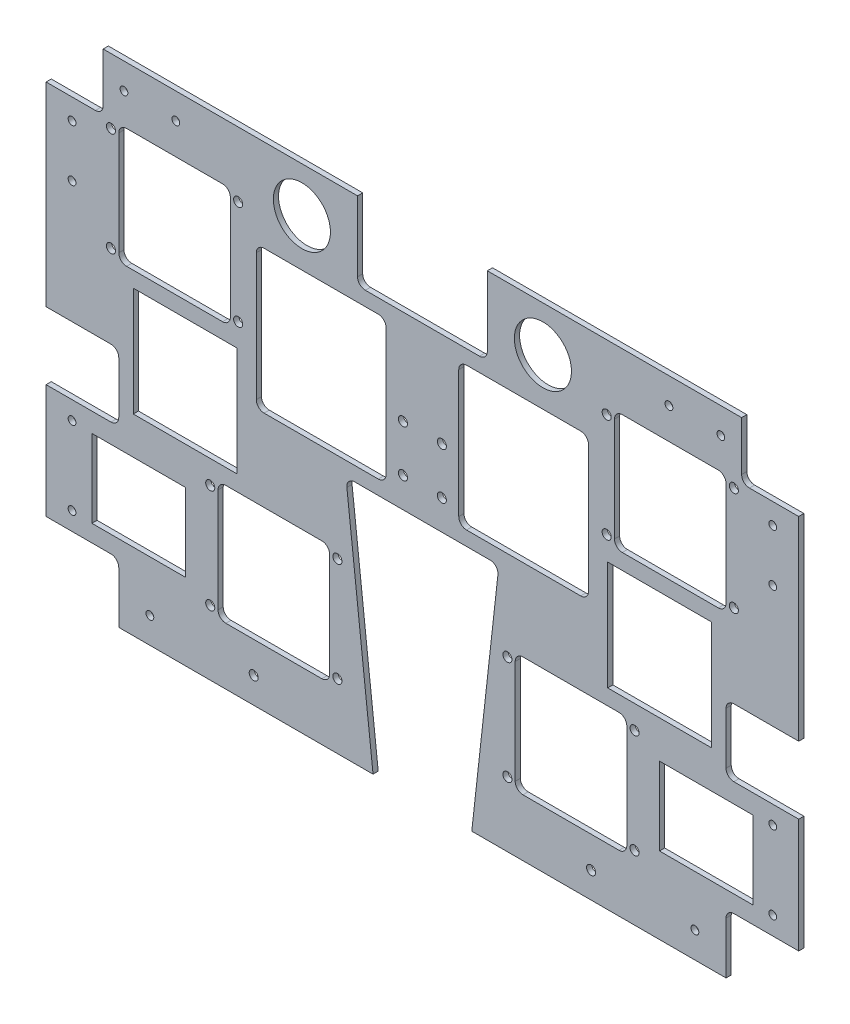
from build123d import *

# Parameters (mm, degrees)
SKETCH_1_W           = 290
SKETCH_1_H           = 190
EXTRUDE_1_DEPTH      = 2
SKETCH_2_W           = 22
SKETCH_2_H           = 22
CUT_EXTRUDE_1_DEPTH  = 2
FILLET_2_R           = 3
FILLET_3_R           = 3
SKETCH_3_W           = 50
SKETCH_3_H           = 30
CUT_EXTRUDE_2_DEPTH  = 10
FILLET_4_R           = 3
CUT_EXTRUDE_3_DEPTH  = 10
FILLET_5_R           = 3
SKETCH_5_R           = 1.75
SKETCH_5_R_2         = 1.5
CUT_EXTRUDE_4_DEPTH  = 10
SKETCH_6_W           = 38.367930324
SKETCH_6_H           = 26
SKETCH_6_W_2         = 43.939038981
CUT_EXTRUDE_5_DEPTH  = 10
FILLET_6_R           = 3
SKETCH_7_R           = 1.75
CUT_EXTRUDE_6_DEPTH  = 10
SKETCH_8_W           = 43
SKETCH_8_H           = 46
CUT_EXTRUDE_7_DEPTH  = 10
FILLET_7_R           = 3
SKETCH_10_R          = 11
SKETCH_10_W          = 40
SKETCH_10_H          = 42
SKETCH_10_W_2        = 36
SKETCH_10_H_2        = 30
CUT_EXTRUDE_9_DEPTH  = 10
SKETCH_11_R          = 1.75
CUT_EXTRUDE_10_DEPTH = 10
SKETCH_9_W           = 50
SKETCH_9_H           = 55
CUT_EXTRUDE_11_DEPTH = 10
FILLET_8_R           = 3


with BuildPart() as part:
    # 草图1 → 凸台-拉伸1 (new body)
    with BuildSketch(Plane.XY):
        Rectangle(SKETCH_1_W, SKETCH_1_H)
    extrude(amount=EXTRUDE_1_DEPTH)

    # 草图2 → 切除-拉伸1 (cut)
    with BuildSketch(Plane(origin=(0, 0, 0), x_dir=(-1, 0, 0), z_dir=(0, 0, -1))):
        with Locations((-134, 84)):
            Rectangle(SKETCH_2_W, SKETCH_2_H)
        with Locations((134, 84)):
            Rectangle(SKETCH_2_W, SKETCH_2_H)
        Polygon((-125, -72), (-145, -72), (-145, -111.869716796), (-117, -111.869716796), (-117, -72), align=None)
        Polygon((117, -72), (125, -72), (145, -72), (145, -111.869716796), (117, -111.869716796), align=None)
    extrude(amount=-CUT_EXTRUDE_1_DEPTH, mode=Mode.SUBTRACT)

    # 圆角2
    fillet_2_edges = [part.edges().sort_by_distance(p)[0] for p in [
        (117, -72, 1),
        (-117, -72, 1),
    ]]
    fillet(fillet_2_edges, radius=FILLET_2_R)

    # 圆角3
    fillet_3_edges = [part.edges().sort_by_distance(p)[0] for p in [
        (-123, 73, 1),
        (123, 73, 1),
    ]]
    fillet(fillet_3_edges, radius=FILLET_3_R)

    # 草图3 → 切除-拉伸2 (cut)
    with BuildSketch(Plane.XY.offset(2)):
        with Locations((0, 80)):
            Rectangle(SKETCH_3_W, SKETCH_3_H)
    extrude(amount=-CUT_EXTRUDE_2_DEPTH, mode=Mode.SUBTRACT)

    # 圆角4
    fillet_4_edges = [part.edges().sort_by_distance(p)[0] for p in [
        (25, 65, 1),
        (-25, 65, 1),
    ]]
    fillet(fillet_4_edges, radius=FILLET_4_R)

    # 草图4 → 切除-拉伸3 (cut)
    with BuildSketch(Plane(origin=(0, 0, 0), x_dir=(-1, 0, 0), z_dir=(0, 0, -1))):
        Polygon((18.975534939, -95.441726104), (29.469060061, -1), (-29.469060061, -1), (-18.975534939, -95.441726104), align=None)
    extrude(amount=-CUT_EXTRUDE_3_DEPTH, mode=Mode.SUBTRACT)

    # 圆角5
    fillet_5_edges = [part.edges().sort_by_distance(p)[0] for p in [
        (29.469060061, -1, 1),
        (-29.469060061, -1, 1),
    ]]
    fillet(fillet_5_edges, radius=FILLET_5_R)

    # 草图5 → 切除-拉伸4 (cut)
    with BuildSketch(Plane(origin=(0, 0, 0), x_dir=(-1, 0, 0), z_dir=(0, 0, -1))):
        with Locations((65, -85)):
            Circle(SKETCH_5_R)
        with Locations((105, -85)):
            Circle(SKETCH_5_R_2)
        with Locations((135, -35)):
            Circle(SKETCH_5_R_2)
        with Locations((-65, -85)):
            Circle(SKETCH_5_R)
        with Locations((-135, -65)):
            Circle(SKETCH_5_R_2)
        with Locations((-135, -35)):
            Circle(SKETCH_5_R_2)
        with Locations((-135, 45)):
            Circle(SKETCH_5_R_2)
        with Locations((-135, 65)):
            Circle(SKETCH_5_R_2)
        with Locations((-115, 85)):
            Circle(SKETCH_5_R_2)
        with Locations((-95, 85)):
            Circle(SKETCH_5_R_2)
        with Locations((95, 85)):
            Circle(SKETCH_5_R_2)
        with Locations((115, 85)):
            Circle(SKETCH_5_R_2)
        with Locations((135, 65)):
            Circle(SKETCH_5_R_2)
        with Locations((135, 45)):
            Circle(SKETCH_5_R_2)
        with Locations((135, -65)):
            Circle(SKETCH_5_R_2)
        with Locations((-105, -85)):
            Circle(SKETCH_5_R_2)
    extrude(amount=-CUT_EXTRUDE_4_DEPTH, mode=Mode.SUBTRACT)

    # 草图6 → 切除-拉伸5 (cut)
    with BuildSketch(Plane(origin=(0, 0, 0), x_dir=(-1, 0, 0), z_dir=(0, 0, -1))):
        with Locations((136.183965162, -15)):
            Rectangle(SKETCH_6_W, SKETCH_6_H)
        with Locations((-138.969519491, -15)):
            Rectangle(SKETCH_6_W_2, SKETCH_6_H)
    extrude(amount=-CUT_EXTRUDE_5_DEPTH, mode=Mode.SUBTRACT)

    # 圆角6
    fillet_6_edges = [part.edges().sort_by_distance(p)[0] for p in [
        (117, -2, 1),
        (117, -28, 1),
        (-117, -28, 1),
        (-117, -2, 1),
    ]]
    fillet(fillet_6_edges, radius=FILLET_6_R)

    # 草图7 → 切除-拉伸6 (cut)
    with BuildSketch(Plane(origin=(0, 0, 0), x_dir=(-1, 0, 0), z_dir=(0, 0, -1))):
        with Locations((81.75, -70)):
            Circle(SKETCH_7_R)
        with Locations((32.75, -70)):
            Circle(SKETCH_7_R)
        with Locations((32.75, -30)):
            Circle(SKETCH_7_R)
        with Locations((81.75, -30)):
            Circle(SKETCH_7_R)
        with Locations((-81.75, -70)):
            Circle(SKETCH_7_R)
        with Locations((-32.75, -70)):
            Circle(SKETCH_7_R)
        with Locations((-32.75, -30)):
            Circle(SKETCH_7_R)
        with Locations((-81.75, -30)):
            Circle(SKETCH_7_R)
        with Locations((-120, 30)):
            Circle(SKETCH_7_R)
        with Locations((-120, 70)):
            Circle(SKETCH_7_R)
        with Locations((-71, 70)):
            Circle(SKETCH_7_R)
        with Locations((-71, 30)):
            Circle(SKETCH_7_R)
        with Locations((71, 70)):
            Circle(SKETCH_7_R)
        with Locations((120, 30)):
            Circle(SKETCH_7_R)
        with Locations((71, 30)):
            Circle(SKETCH_7_R)
        with Locations((120, 70)):
            Circle(SKETCH_7_R)
    extrude(amount=-CUT_EXTRUDE_6_DEPTH, mode=Mode.SUBTRACT)

    # 草图8 → 切除-拉伸7 (cut)
    with BuildSketch(Plane(origin=(0, 0, 0), x_dir=(-1, 0, 0), z_dir=(0, 0, -1))):
        with Locations((-95.5, 50)):
            Rectangle(SKETCH_8_W, SKETCH_8_H)
        with Locations((-57.25, -50)):
            Rectangle(SKETCH_8_W, SKETCH_8_H)
        with Locations((57.25, -50)):
            Rectangle(SKETCH_8_W, SKETCH_8_H)
        with Locations((95.5, 50)):
            Rectangle(SKETCH_8_W, SKETCH_8_H)
    extrude(amount=-CUT_EXTRUDE_7_DEPTH, mode=Mode.SUBTRACT)

    # 圆角7
    fillet_7_edges = [part.edges().sort_by_distance(p)[0] for p in [
        (-117, 73, 1),
        (-117, 27, 1),
        (-74, 27, 1),
        (-74, 73, 1),
        (-78.75, -27, 1),
        (-78.75, -73, 1),
        (-35.75, -73, 1),
        (-35.75, -27, 1),
        (35.75, -27, 1),
        (35.75, -73, 1),
        (78.75, -73, 1),
        (78.75, -27, 1),
        (74, 73, 1),
        (74, 27, 1),
        (117, 27, 1),
        (117, 73, 1),
    ]]
    fillet(fillet_7_edges, radius=FILLET_7_R)

    # 草图10 → 切除-拉伸9 (cut)
    with BuildSketch(Plane.XY.offset(2)):
        with Locations((-46.436017542, 77.667392483)):
            Circle(SKETCH_10_R)
        with Locations(Location((46.436017542, 77.667392483, 0), (0, 0, 180))):
            Circle(SKETCH_10_R)
        with Locations((91.396155993, 0)):
            Rectangle(SKETCH_10_W, SKETCH_10_H)
        with Locations((-91.396155993, 0)):
            Rectangle(SKETCH_10_W, SKETCH_10_H)
        with Locations((-109.352757312, -50.443602375)):
            Rectangle(SKETCH_10_W_2, SKETCH_10_H_2)
        with Locations((109.352757312, -50.443602375)):
            Rectangle(SKETCH_10_W_2, SKETCH_10_H_2)
    extrude(amount=-CUT_EXTRUDE_9_DEPTH, mode=Mode.SUBTRACT)

    # 草图11 → 切除-拉伸10 (cut)
    with BuildSketch(Plane(origin=(0, 0, 0), x_dir=(-1, 0, 0), z_dir=(0, 0, -1))):
        with Locations((7.5, 10.5)):
            Circle(SKETCH_11_R)
        with Locations((-7.5, 10.5)):
            Circle(SKETCH_11_R)
        with Locations((7.5, 28.5)):
            Circle(SKETCH_11_R)
        with Locations((-7.5, 28.5)):
            Circle(SKETCH_11_R)
    extrude(amount=-CUT_EXTRUDE_10_DEPTH, mode=Mode.SUBTRACT)

    # 草图9 → 切除-拉伸11 (cut)
    with BuildSketch(Plane(origin=(0, 0, 0), x_dir=(-1, 0, 0), z_dir=(0, 0, -1))):
        with Locations((-39, 32)):
            Rectangle(SKETCH_9_W, SKETCH_9_H)
        with Locations((39, 32)):
            Rectangle(SKETCH_9_W, SKETCH_9_H)
    extrude(amount=-CUT_EXTRUDE_11_DEPTH, mode=Mode.SUBTRACT)

    # 圆角8
    fillet_8_edges = [part.edges().sort_by_distance(p)[0] for p in [
        (14, 59.5, 1),
        (14, 4.5, 1),
        (64, 4.5, 1),
        (64, 59.5, 1),
        (-64, 59.5, 1),
        (-64, 4.5, 1),
        (-14, 4.5, 1),
        (-14, 59.5, 1),
    ]]
    fillet(fillet_8_edges, radius=FILLET_8_R)


solid = part.part
